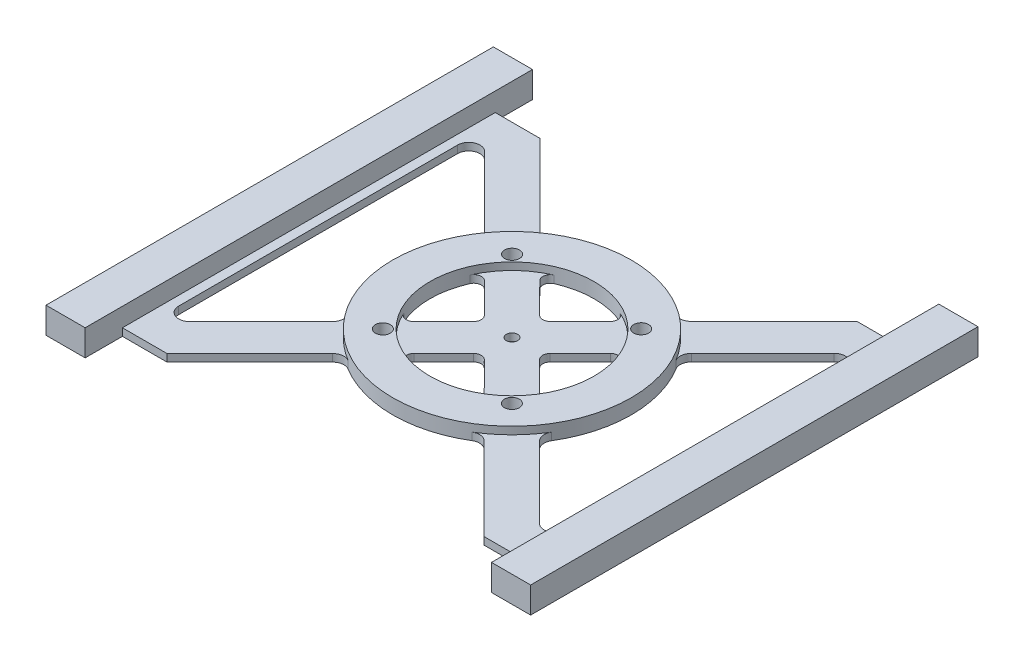
from build123d import *
from build123d.topology import SkipClean

# Parameters (mm, degrees)
SKETCH1_R             = 32
SKETCH1_R_2           = 22
BOSS_EXTRUDE2_DEPTH   = 4
SKETCH3_W             = 10.5
SKETCH3_H             = 120
BOSS_EXTRUDE4_DEPTH   = 7
BOSS_EXTRUDE4_2_DEPTH = 7
BOSS_EXTRUDE5_DEPTH   = 2
SKETCH5_R             = 1.5
CUT_EXTRUDE1_DEPTH    = 4
SKETCH6_R             = 2
CUT_EXTRUDE2_DEPTH    = 4


with BuildPart() as part:
    # Sketch1 → Boss-Extrude2 (new body)
    with BuildSketch(Plane(origin=(0, 0, 0), x_dir=(1, 0, 0), z_dir=(0, 1, 0))):
        with Locations(Location((0, 0, 0), (0, 0, 270))):
            Circle(SKETCH1_R)
        with Locations(Location((0, 0, 0), (0, 0, 270))):
            Circle(SKETCH1_R_2, mode=Mode.SUBTRACT)
    extrude(amount=BOSS_EXTRUDE2_DEPTH)



with BuildPart() as body_2:
    # Sketch3 → Boss-Extrude4 (new body)
    with BuildSketch(Plane(origin=(0, 0, 0), x_dir=(1, 0, 0), z_dir=(0, 1, 0))):
        with Locations((-59.75, 0)):
            Rectangle(SKETCH3_W, SKETCH3_H)
    extrude(amount=BOSS_EXTRUDE4_DEPTH)


with BuildPart() as body_3:
    # Sketch3 → Boss-Extrude4 2 (new body)
    with BuildSketch(Plane(origin=(0, 0, 0), x_dir=(1, 0, 0), z_dir=(0, 1, 0))):
        with Locations((59.75, 0)):
            Rectangle(SKETCH3_W, SKETCH3_H)
    extrude(amount=BOSS_EXTRUDE4_2_DEPTH)


with BuildPart() as part_1:
    with SkipClean():  # the faces are left unmerged after this step: merging them gives an invalid solid
        add(part.part)

        add(body_2.part)  # Boss-Extrude5 merges body 2

        add(body_3.part)  # Boss-Extrude5 merges body 3
        # Sketch4 → Boss-Extrude5 (add)
        with BuildSketch(Plane(origin=(0, 0, 0), x_dir=(1, 0, 0), z_dir=(0, 1, 0))):
            with BuildLine():
                Line((-54.5, 50), (-42.5, 50))
                Line((-42.5, 50), (-20.316435899, 27.780252561))
                ThreePointArc((-20.316435899, 27.780252561), (-18.551903635, 26.921342904), (-16.633954414, 27.336999845))
                ThreePointArc((-16.633954414, 27.336999845), (0, 32), (16.633954414, 27.336999845))
                ThreePointArc((16.633954414, 27.336999845), (18.551903635, 26.921342904), (20.316435899, 27.780252561))
                Line((20.316435899, 27.780252561), (42.5, 50))
                Line((42.5, 50), (54.5, 50))
                Line((54.5, 50), (54.5, -50))
                Line((54.5, -50), (42.5, -50))
                Line((42.5, -50), (20.316435899, -27.780252561))
                ThreePointArc((20.316435899, -27.780252561), (18.551903635, -26.921342904), (16.633954414, -27.336999845))
                ThreePointArc((16.633954414, -27.336999845), (0, -32), (-16.633954414, -27.336999845))
                ThreePointArc((-16.633954414, -27.336999845), (-18.551903635, -26.921342904), (-20.316435899, -27.780252561))
                Line((-20.316435899, -27.780252561), (-42.5, -50))
                Line((-42.5, -50), (-54.5, -50))
                Line((-54.5, -50), (-54.5, 50))
            make_face()
            with BuildLine():
                Line((-52, -37.403142366), (-52, 37.403142366))
                ThreePointArc((-52, 37.403142366), (-50.146920927, 40.175248495), (-46.876951741, 39.522733386))
                Line((-46.876951741, 39.522733386), (-27.747104804, 20.361683992))
                ThreePointArc((-27.747104804, 20.361683992), (-26.891072048, 18.595754257), (-27.309854229, 16.678485003))
                ThreePointArc((-27.309854229, 16.678485003), (-32, 0), (-27.309854229, -16.678485003))
                ThreePointArc((-27.309854229, -16.678485003), (-26.891072048, -18.595754257), (-27.747104804, -20.361683992))
                Line((-27.747104804, -20.361683992), (-46.876951741, -39.522733386))
                ThreePointArc((-46.876951741, -39.522733386), (-50.146920927, -40.175248495), (-52, -37.403142366))
            make_face(mode=Mode.SUBTRACT)
            with BuildLine():
                Line((52, -37.403142366), (52, 37.403142366))
                ThreePointArc((52, 37.403142366), (50.146920927, 40.175248495), (46.876951741, 39.522733386))
                Line((46.876951741, 39.522733386), (27.747104804, 20.361683992))
                ThreePointArc((27.747104804, 20.361683992), (26.891072048, 18.595754257), (27.309854229, 16.678485003))
                ThreePointArc((27.309854229, 16.678485003), (32, 0), (27.309854229, -16.678485003))
                ThreePointArc((27.309854229, -16.678485003), (26.891072048, -18.595754257), (27.747104804, -20.361683992))
                Line((27.747104804, -20.361683992), (46.876951741, -39.522733386))
                ThreePointArc((46.876951741, -39.522733386), (50.146920927, -40.175248495), (52, -37.403142366))
            make_face(mode=Mode.SUBTRACT)
            with BuildLine():
                Line((-8.829338029, -1.41306068), (-16.884830668, -9.481692534))
                ThreePointArc((-16.884830668, -9.481692534), (-18.667420028, -10.034629474), (-20.130215791, -8.875495039))
                ThreePointArc((-20.130215791, -8.875495039), (-22, 0), (-20.130215791, 8.875495039))
                ThreePointArc((-20.130215791, 8.875495039), (-18.667420028, 10.034629474), (-16.884830668, 9.481692534))
                Line((-16.884830668, 9.481692534), (-8.829338029, 1.41306068))
                ThreePointArc((-8.829338029, 1.41306068), (-8.244703535, 0), (-8.829338029, -1.41306068))
            make_face(mode=Mode.SUBTRACT)
            with BuildLine():
                Line((8.829338029, -1.41306068), (16.884830668, -9.481692534))
                ThreePointArc((16.884830668, -9.481692534), (18.667420028, -10.034629474), (20.130215791, -8.875495039))
                ThreePointArc((20.130215791, -8.875495039), (22, 0), (20.130215791, 8.875495039))
                ThreePointArc((20.130215791, 8.875495039), (18.667420028, 10.034629474), (16.884830668, 9.481692534))
                Line((16.884830668, 9.481692534), (8.829338029, 1.41306068))
                ThreePointArc((8.829338029, 1.41306068), (8.244703535, 0), (8.829338029, -1.41306068))
            make_face(mode=Mode.SUBTRACT)
            with BuildLine():
                Line((-9.454161763, 16.900261103), (-1.415365506, 8.848352865))
                ThreePointArc((-1.415365506, 8.848352865), (0, 8.261413545), (1.415365506, 8.848352865))
                Line((1.415365506, 8.848352865), (9.454161763, 16.900261103))
                ThreePointArc((9.454161763, 16.900261103), (10.00419278, 18.683749248), (8.842675883, 20.144653962))
                ThreePointArc((8.842675883, 20.144653962), (0, 22), (-8.842675883, 20.144653962))
                ThreePointArc((-8.842675883, 20.144653962), (-10.00419278, 18.683749248), (-9.454161763, 16.900261103))
            make_face(mode=Mode.SUBTRACT)
            with BuildLine():
                Line((9.454161763, -16.900261103), (1.415365506, -8.848352865))
                ThreePointArc((1.415365506, -8.848352865), (0, -8.261413545), (-1.415365506, -8.848352865))
                Line((-1.415365506, -8.848352865), (-9.454161763, -16.900261103))
                ThreePointArc((-9.454161763, -16.900261103), (-10.00419278, -18.683749248), (-8.842675883, -20.144653962))
                ThreePointArc((-8.842675883, -20.144653962), (0, -22), (8.842675883, -20.144653962))
                ThreePointArc((8.842675883, -20.144653962), (10.00419278, -18.683749248), (9.454161763, -16.900261103))
            make_face(mode=Mode.SUBTRACT)
        extrude(amount=BOSS_EXTRUDE5_DEPTH)

    # Sketch5 → Cut-Extrude1 (cut)
    with SkipClean():  # the faces are left unmerged after this step: merging them gives an invalid solid
        with BuildSketch(Plane(origin=(0, 2, 0), x_dir=(1, 0, 0), z_dir=(0, 1, 0))):
            with Locations(Location((0, 0, 0), (0, 0, 270))):
                Circle(SKETCH5_R)
        extrude(amount=-CUT_EXTRUDE1_DEPTH, mode=Mode.SUBTRACT)

    # Sketch6 → Cut-Extrude2 (cut)
    with SkipClean():  # the faces are left unmerged after this step: merging them gives an invalid solid
        with BuildSketch(Plane.XZ):
            with Locations(Location((-17.309993329, -17.338227446, 0), (0, 0, 270))):
                Circle(SKETCH6_R)
            with Locations(Location((17.309993329, -17.338227446, 0), (0, 0, 270))):
                Circle(SKETCH6_R)
            with Locations(Location((17.309993329, 17.338227446, 0), (0, 0, 270))):
                Circle(SKETCH6_R)
            with Locations(Location((-17.309993329, 17.338227446, 0), (0, 0, 270))):
                Circle(SKETCH6_R)
        extrude(amount=-CUT_EXTRUDE2_DEPTH, mode=Mode.SUBTRACT)


solid = part_1.part
